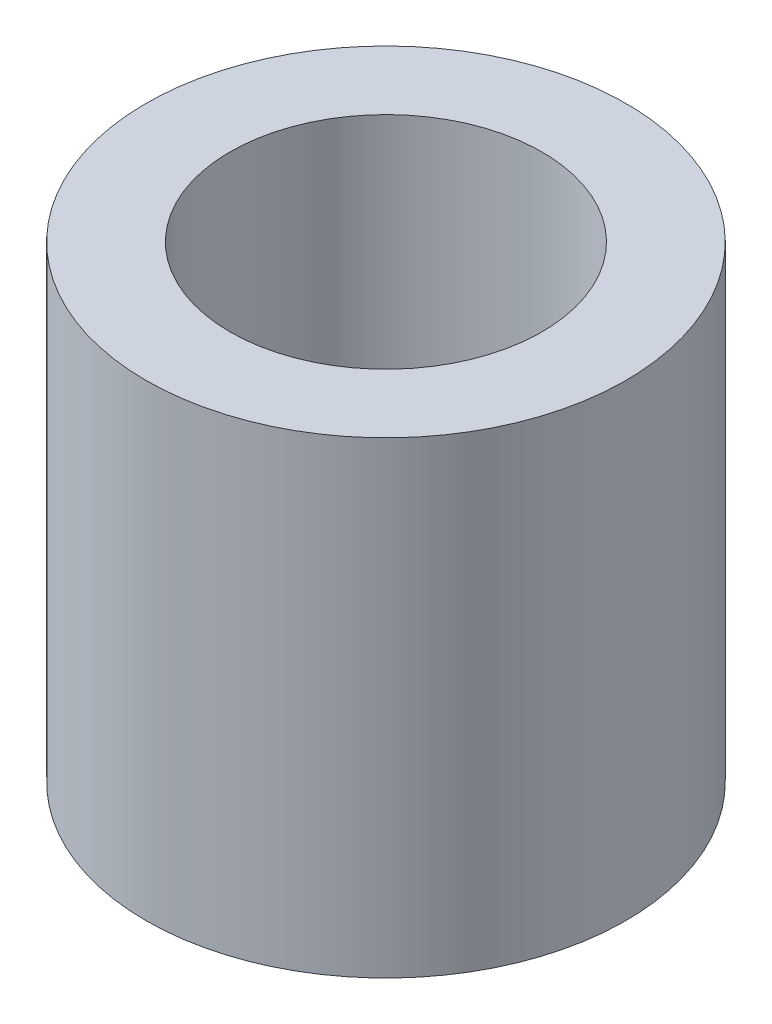
from build123d import *

# Parameters (mm, degrees)
SKETCH1_R           = 4
SKETCH1_R_2         = 2.6
BOSS_EXTRUDE1_DEPTH = 7.8


with BuildPart() as part:
    # Sketch1 → Boss-Extrude1 (new body)
    with BuildSketch(Plane(origin=(0, 0, 0), x_dir=(1, 0, 0), z_dir=(0, 1, 0))):
        with Locations(Location((0, 0, 0), (0, 0, 270))):
            Circle(SKETCH1_R)
        with Locations(Location((0, 0, 0), (0, 0, 270))):
            Circle(SKETCH1_R_2, mode=Mode.SUBTRACT)
    extrude(amount=BOSS_EXTRUDE1_DEPTH)


solid = part.part
